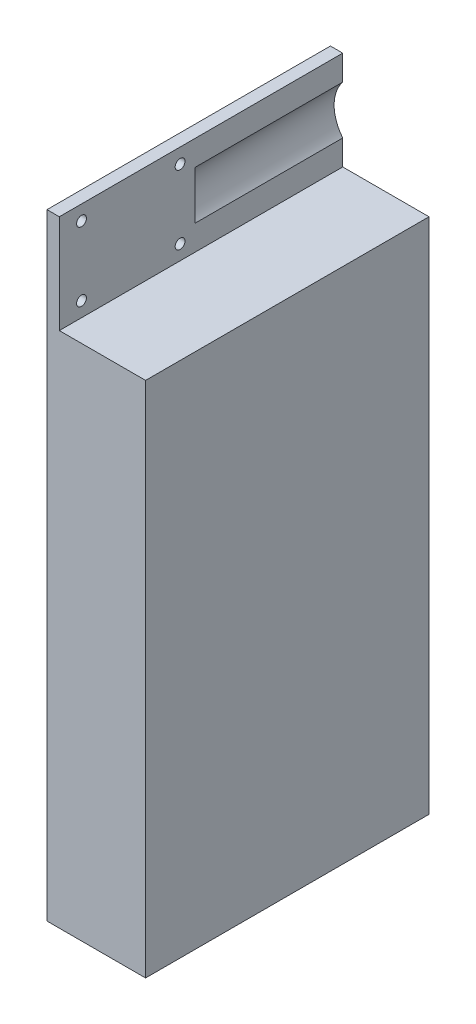
from build123d import *

# Parameters (mm, degrees)
BOSS_EXTRUDE1_DEPTH = 115
SKETCH2_R           = 2
CUT_EXTRUDE1_DEPTH  = 243.744721879
SKETCH3_R           = 15.5
CUT_EXTRUDE2_DEPTH  = 60


with BuildPart() as part:
    # Sketch1 → Boss-Extrude1 (new body)
    with BuildSketch(Plane.XY):
        Polygon((0, 0), (0, 40), (-5, 40), (-5, -210), (35, -210), (35, 0), align=None)
    extrude(amount=BOSS_EXTRUDE1_DEPTH)

    # Sketch2 → Cut-Extrude1 (cut, through all)
    with BuildSketch(Plane.ZY.offset(5)):
        with Locations(Location((106, 34, 0), (0, 0, 270))):
            Circle(SKETCH2_R)
        with Locations(Location((66, 34, 0), (0, 0, 270))):
            Circle(SKETCH2_R)
        with Locations((66, 6)):
            Circle(SKETCH2_R)
        with Locations((106, 6)):
            Circle(SKETCH2_R)
    extrude(amount=-CUT_EXTRUDE1_DEPTH, mode=Mode.SUBTRACT)

    # Sketch3 → Cut-Extrude2 (cut)
    with BuildSketch(Plane(origin=(0, 0, 0), x_dir=(-1, 0, 0), z_dir=(0, 0, -1))):
        with Locations((-12, 20)):
            Circle(SKETCH3_R)
    extrude(amount=-CUT_EXTRUDE2_DEPTH, mode=Mode.SUBTRACT)


solid = part.part
